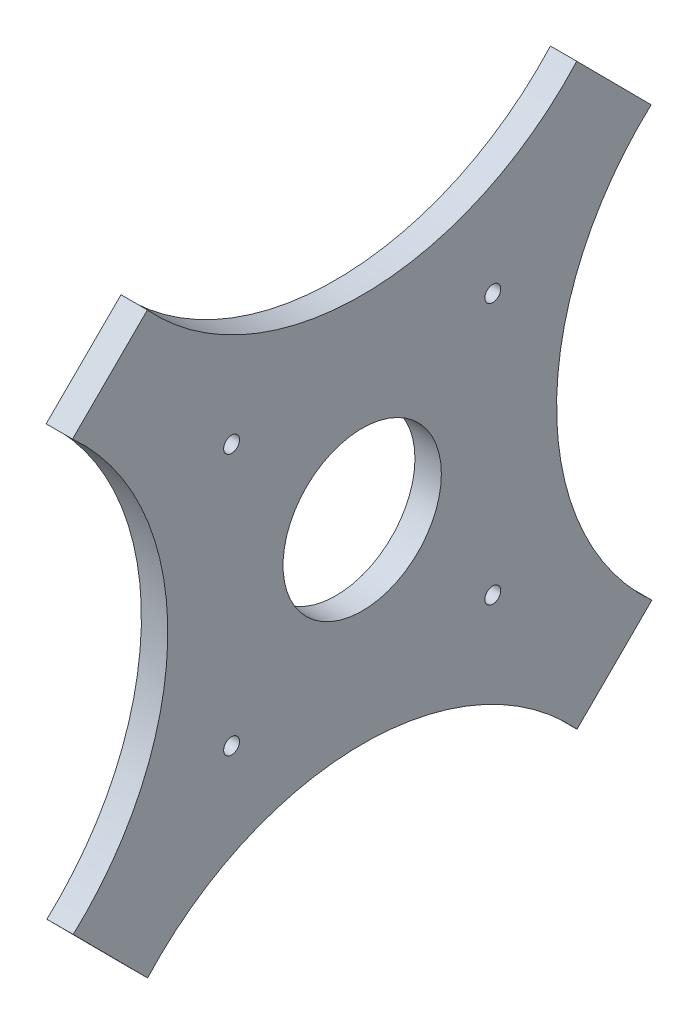
from build123d import *

# Parameters (mm, degrees)
SKETCH_1_R      = 15
SKETCH_1_R_2    = 1.5
EXTRUDE_1_DEPTH = 5


with BuildPart() as part:
    # 草图1 → 凸台-拉伸1 (new body)
    with BuildSketch(Plane(origin=(0, 0, 0), x_dir=(0, 0, -1), z_dir=(1, 0, 0))):
        with BuildLine():
            Line((-54.891168705, 40.66351007), (-40.699692853, 54.756132721))
            ThreePointArc((-40.699692853, 54.756132721), (0.011760124, 36.837223596), (40.66351007, 54.891168705))
            Line((40.66351007, 54.891168705), (54.756132721, 40.699692853))
            ThreePointArc((54.756132721, 40.699692853), (36.837223596, -0.011760124), (54.891168705, -40.66351007))
            Line((54.891168705, -40.66351007), (40.699692853, -54.756132721))
            ThreePointArc((40.699692853, -54.756132721), (-0.011760124, -36.837223596), (-40.66351007, -54.891168705))
            Line((-40.66351007, -54.891168705), (-54.756132721, -40.699692853))
            ThreePointArc((-54.756132721, -40.699692853), (-36.837223596, 0.011760124), (-54.891168705, 40.66351007))
        make_face()
        Circle(SKETCH_1_R, mode=Mode.SUBTRACT)
        with Locations((24.748737342, 24.748737342)):
            Circle(SKETCH_1_R_2, mode=Mode.SUBTRACT)
        with Locations((24.748737342, -24.748737342)):
            Circle(SKETCH_1_R_2, mode=Mode.SUBTRACT)
        with Locations((-24.748737342, -24.748737342)):
            Circle(SKETCH_1_R_2, mode=Mode.SUBTRACT)
        with Locations((-24.748737342, 24.748737342)):
            Circle(SKETCH_1_R_2, mode=Mode.SUBTRACT)
    extrude(amount=EXTRUDE_1_DEPTH)


solid = part.part
